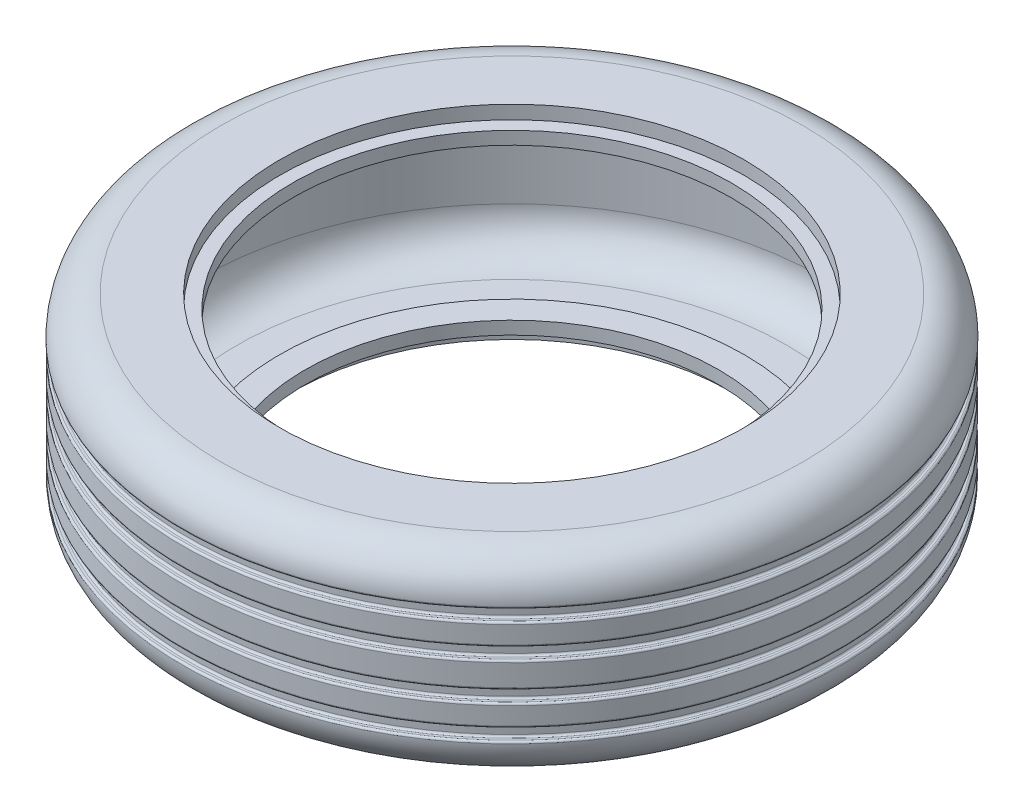
from build123d import *


with BuildPart() as part:
    # Sketch1 → Revolve1 (revolve)
    with BuildSketch(Plane(origin=(0, 0, 0), x_dir=(0, 0, -1), z_dir=(1, 0, 0)), mode=Mode.PRIVATE) as revolve1_sk:
        with BuildLine():
            Line((-204.032589954, 50.47451672), (-204.032589954, 70.47451672))
            Line((-204.032589954, 70.47451672), (-224.032589954, 70.47451672))
            Line((-224.032589954, 70.47451672), (-224.032589954, 91.386162075))
            Line((-224.032589954, 91.386162075), (-315.480825894, 91.386162075))
            ThreePointArc((-315.480825894, 91.386162075), (-357.490039765, 73.985375945), (-374.890825894, 31.976162075))
            ThreePointArc((-374.890825894, 31.976162075), (-373.751247075, 29.622689528), (-371.198270541, 29.057195291))
            Line((-371.198270541, 29.057195291), (-367.954016504, 29.057195291))
            ThreePointArc((-367.954016504, 29.057195291), (-365.83269616, 28.178515635), (-364.954016504, 26.057195291))
            Line((-364.954016504, 26.057195291), (-364.954016504, 14.057195291))
            ThreePointArc((-364.954016504, 14.057195291), (-365.83269616, 11.935874948), (-367.954016504, 11.057195291))
            Line((-367.954016504, 11.057195291), (-371.442524579, 11.057195291))
            ThreePointArc((-371.442524579, 11.057195291), (-373.563844923, 10.178515635), (-374.442524579, 8.057195291))
            Line((-374.442524579, 8.057195291), (-374.442524579, -19.183204346))
            ThreePointArc((-374.442524579, -19.183204346), (-373.563844923, -21.30452469), (-371.442524579, -22.183204346))
            Line((-371.442524579, -22.183204346), (-367.954016504, -22.183204346))
            ThreePointArc((-367.954016504, -22.183204346), (-365.83269616, -23.061884003), (-364.954016504, -25.183204346))
            Line((-364.954016504, -25.183204346), (-364.954016504, -37.183204346))
            ThreePointArc((-364.954016504, -37.183204346), (-365.83269616, -39.30452469), (-367.954016504, -40.183204346))
            Line((-367.954016504, -40.183204346), (-371.442524579, -40.183204346))
            ThreePointArc((-371.442524579, -40.183204346), (-373.563844923, -41.061884003), (-374.442524579, -43.183204346))
            Line((-374.442524579, -43.183204346), (-374.442524579, -76.702405071))
            ThreePointArc((-374.442524579, -76.702405071), (-373.563844923, -78.823725414), (-371.442524579, -79.702405071))
            Line((-371.442524579, -79.702405071), (-367.954016504, -79.702405071))
            ThreePointArc((-367.954016504, -79.702405071), (-365.83269616, -80.581084727), (-364.954016504, -82.702405071))
            Line((-364.954016504, -82.702405071), (-364.954016504, -94.702405071))
            ThreePointArc((-364.954016504, -94.702405071), (-365.83269616, -96.823725414), (-367.954016504, -97.702405071))
            Line((-367.954016504, -97.702405071), (-371.442524579, -97.702405071))
            ThreePointArc((-371.442524579, -97.702405071), (-373.563844923, -98.581084727), (-374.442524579, -100.702405071))
            Line((-374.442524579, -100.702405071), (-374.442524579, -127.942804709))
            ThreePointArc((-374.442524579, -127.942804709), (-373.563844923, -130.064125052), (-371.442524579, -130.942804709))
            Line((-371.442524579, -130.942804709), (-367.954016504, -130.942804709))
            ThreePointArc((-367.954016504, -130.942804709), (-365.83269616, -131.821484365), (-364.954016504, -133.942804709))
            Line((-364.954016504, -133.942804709), (-364.954016504, -145.942804709))
            ThreePointArc((-364.954016504, -145.942804709), (-365.83269616, -148.064125052), (-367.954016504, -148.942804709))
            Line((-367.954016504, -148.942804709), (-371.433595296, -148.942804709))
            ThreePointArc((-371.433595296, -148.942804709), (-373.573772191, -149.840510044), (-374.433116941, -151.996376137))
            ThreePointArc((-374.433116941, -151.996376137), (-356.665031964, -193.318119728), (-315.032589954, -210.34548328))
            Line((-315.032589954, -210.34548328), (-204.38814551, -210.34548328))
            Line((-204.38814551, -210.34548328), (-204.38814551, -190.34548328))
            Line((-204.38814551, -190.34548328), (-184.38814551, -190.34548328))
            Line((-184.38814551, -190.34548328), (-184.38814551, -170.34548328))
            Line((-184.38814551, -170.34548328), (-224.38814551, -170.34548328))
            Line((-224.38814551, -170.34548328), (-224.38814551, -190.34548328))
            Line((-224.38814551, -190.34548328), (-290.032589954, -190.34548328))
            ThreePointArc((-290.032589954, -190.34548328), (-332.041803824, -172.94469715), (-349.442589954, -130.93548328))
            Line((-349.442589954, -130.93548328), (-349.442589954, 11.06451672))
            ThreePointArc((-349.442589954, 11.06451672), (-332.041803824, 53.07373059), (-290.032589954, 70.47451672))
            Line((-290.032589954, 70.47451672), (-244.032589954, 70.47451672))
            Line((-244.032589954, 70.47451672), (-244.032589954, 50.47451672))
            Line((-244.032589954, 50.47451672), (-204.032589954, 50.47451672))
        make_face()
    revolve(revolve1_sk.sketch.rotate(Axis((0, -170.34548328, -135.61185449), (0, 1, 0)), 180), axis=Axis((0, -170.34548328, -135.61185449), (0, 1, 0)))


solid = part.part
